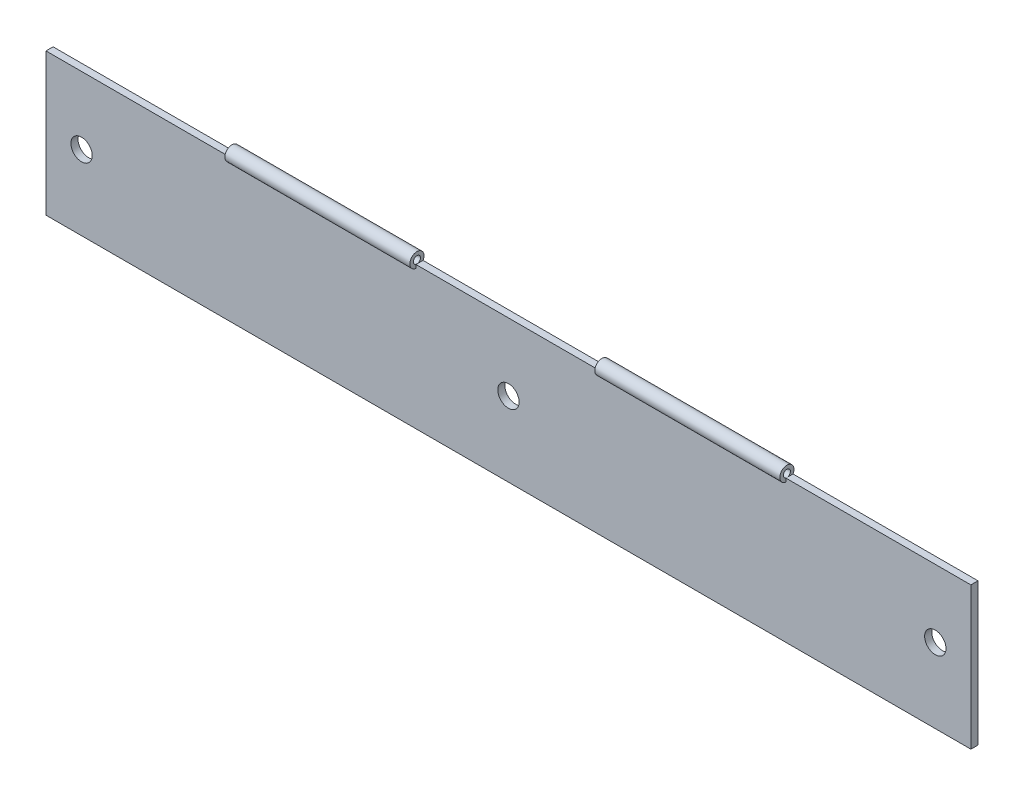
from build123d import *

# Parameters (mm, degrees)
SKETCH1_W           = 130
SKETCH1_H           = 20
SKETCH1_R           = 1.5
BOSS_EXTRUDE1_DEPTH = 1
BOSS_EXTRUDE2_START = 26
SKETCH3_R           = 1
SKETCH3_R_2         = 0.5
BOSS_EXTRUDE2_DEPTH = 26
LPATTERN1_COUNT     = 2
LPATTERN1_PITCH     = 52


with BuildPart() as part:
    # Sketch1 → Boss-Extrude1 (new body)
    with BuildSketch(Plane.XY):
        with Locations((65, 10)):
            Rectangle(SKETCH1_W, SKETCH1_H)
        with Locations((65, 10.5)):
            Circle(SKETCH1_R, mode=Mode.SUBTRACT)
        with Locations((5, 10.5)):
            Circle(SKETCH1_R, mode=Mode.SUBTRACT)
        with Locations((125, 10.5)):
            Circle(SKETCH1_R, mode=Mode.SUBTRACT)
    extrude(amount=BOSS_EXTRUDE1_DEPTH)

    # Sketch3 → Boss-Extrude2 (add)
    with BuildSketch(Plane(origin=(0, 0, 0), x_dir=(0, 0, -1), z_dir=(1, 0, 0)).offset(BOSS_EXTRUDE2_START)):
        with Locations((-0.863530112, 20.504297279)):
            Circle(SKETCH3_R)
        with Locations((-0.863530112, 20.504297279)):
            Circle(SKETCH3_R_2, mode=Mode.SUBTRACT)
    boss_extrude2 = extrude(amount=BOSS_EXTRUDE2_DEPTH)

    # LPattern1: Boss-Extrude2 ×2
    with Locations(*[(i * LPATTERN1_PITCH, 0, 0) for i in range(1, LPATTERN1_COUNT)]):
        add(boss_extrude2)


solid = part.part
